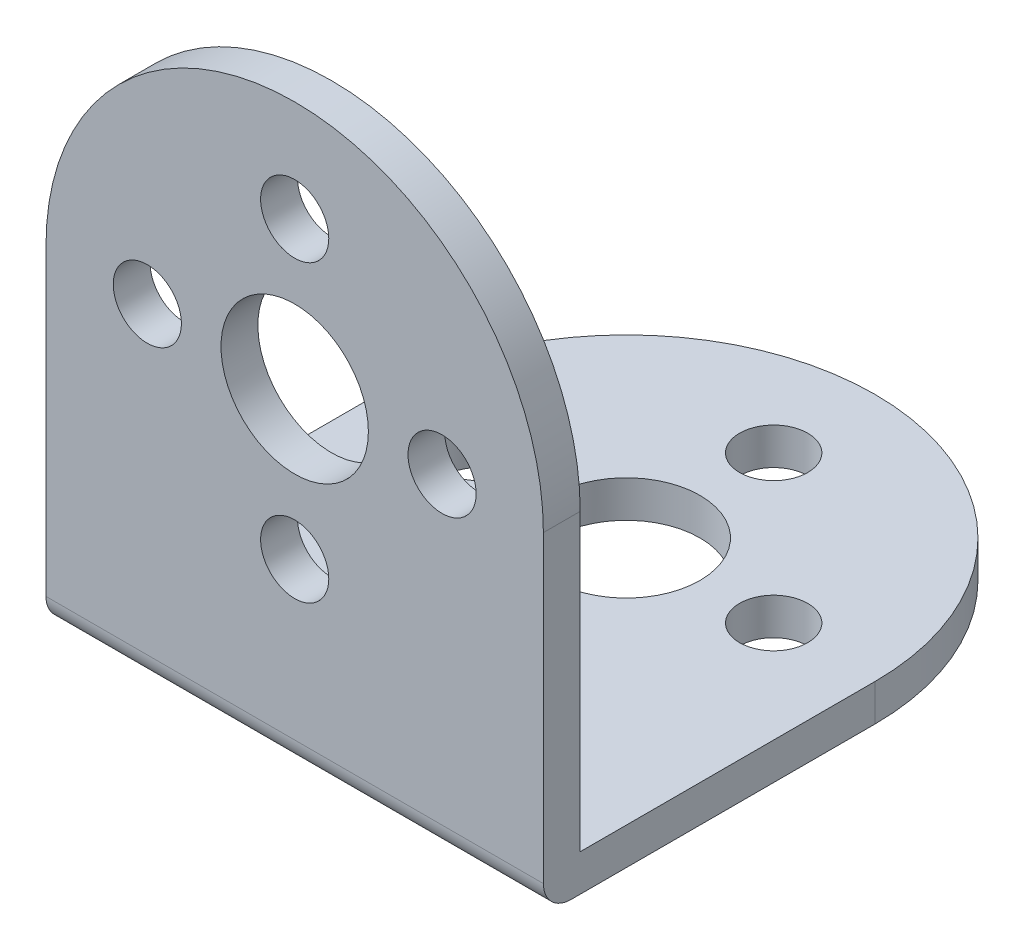
from build123d import *

# Parameters (mm, degrees)
BOSS_EXTRUDE1_DEPTH = 13.5
FILLET1_RADIUS      = 13.5
FILLET1_LENGTH      = 2
FILLET2_RADIUS      = 13.5
FILLET2_LENGTH      = 2
SKETCH3_R           = 4
SKETCH3_R_2         = 1.85
CUT_EXTRUDE1_DEPTH  = 47.548361948
SKETCH4_R           = 4
SKETCH4_R_2         = 1.85
CUT_EXTRUDE2_DEPTH  = 47.548361948
FILLET3_R           = 1.5


with BuildPart() as part:
    # Sketch1 → Boss-Extrude1 (new, symmetric)
    with BuildSketch(Plane(origin=(0, 0, 0), x_dir=(0, 0, -1), z_dir=(1, 0, 0))):
        Polygon((0, 0), (31.5, 0), (31.5, 2), (2, 2), (2, 31.5), (0, 31.5), align=None)
    extrude(amount=BOSS_EXTRUDE1_DEPTH, both=True)

    # Fillet1: full round fillet: the end face becomes a half cylinder, R = half its width
    fillet1_face = Plane((0, 31.5, -1), x_dir=(0, 0, 1), z_dir=(0, 1, 0))  # on the end face: x along it, z out of the body
    fillet1_slab = fillet1_face.offset(-FILLET1_RADIUS / 2) * Box(FILLET1_LENGTH, 2 * FILLET1_RADIUS, FILLET1_RADIUS, mode=Mode.PRIVATE)  # the body's end, R deep
    fillet1_round = Plane((0, 18, -1), x_dir=(0, 1, 0), z_dir=(0, 0, 1)) * Cylinder(FILLET1_RADIUS, FILLET1_LENGTH, mode=Mode.PRIVATE)  # its axis R under the face
    add(fillet1_slab - fillet1_round, mode=Mode.SUBTRACT)

    # Fillet2: full round fillet: the end face becomes a half cylinder, R = half its width
    fillet2_face = Plane((0, 1, -31.5), x_dir=(0, 1, 0), z_dir=(0, 0, -1))  # on the end face: x along it, z out of the body
    fillet2_slab = fillet2_face.offset(-FILLET2_RADIUS / 2) * Box(FILLET2_LENGTH, 2 * FILLET2_RADIUS, FILLET2_RADIUS, mode=Mode.PRIVATE)  # the body's end, R deep
    fillet2_round = Plane((0, 1, -18), x_dir=(0, 0, -1), z_dir=(0, 1, 0)) * Cylinder(FILLET2_RADIUS, FILLET2_LENGTH, mode=Mode.PRIVATE)  # its axis R under the face
    add(fillet2_slab - fillet2_round, mode=Mode.SUBTRACT)

    # Sketch3 → Cut-Extrude1 (cut, through all)
    with BuildSketch(Plane.XY):
        with Locations((0, 18)):
            Circle(SKETCH3_R)
        with Locations((8, 18)):
            Circle(SKETCH3_R_2)
        with Locations((-8, 18)):
            Circle(SKETCH3_R_2)
        with Locations((0, 10)):
            Circle(SKETCH3_R_2)
        with Locations((0, 26)):
            Circle(SKETCH3_R_2)
    extrude(amount=-CUT_EXTRUDE1_DEPTH, mode=Mode.SUBTRACT)

    # Sketch4 → Cut-Extrude2 (cut, through all)
    with BuildSketch(Plane.XZ):
        with Locations(Location((0, -18, 0), (0, 0, 270))):
            Circle(SKETCH4_R)
        with Locations(Location((8, -18, 0), (0, 0, 270))):
            Circle(SKETCH4_R_2)
        with Locations(Location((-8, -18, 0), (0, 0, 270))):
            Circle(SKETCH4_R_2)
        with Locations(Location((0, -26, 0), (0, 0, 270))):
            Circle(SKETCH4_R_2)
        with Locations(Location((0, -10, 0), (0, 0, 270))):
            Circle(SKETCH4_R_2)
    extrude(amount=-CUT_EXTRUDE2_DEPTH, mode=Mode.SUBTRACT)

    # Fillet3
    fillet3_edges = [part.edges().sort_by_distance(p)[0] for p in [
        (0, 0, 0),
    ]]
    fillet(fillet3_edges, radius=FILLET3_R)


solid = part.part
